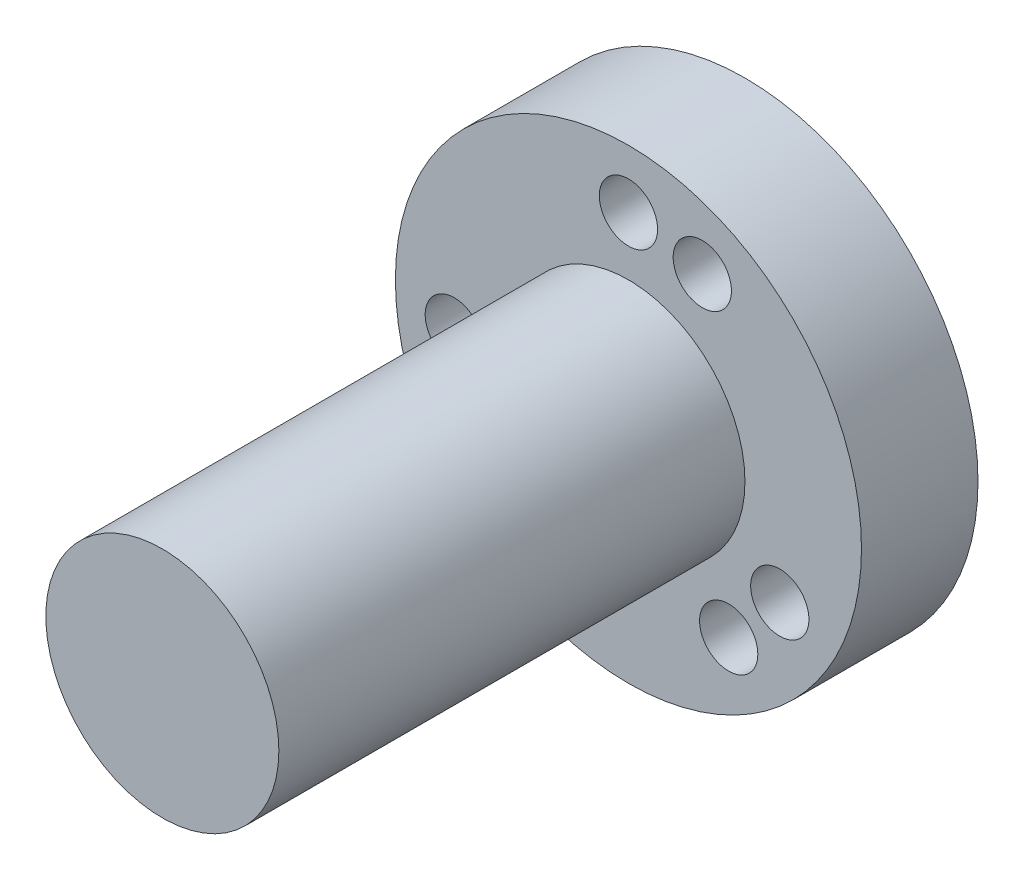
from build123d import *

# Parameters (mm, degrees)
SKETCH_1_R      = 2.5
EXTRUDE_1_DEPTH = 1
SKETCH_2_R      = 6
SKETCH_2_R_2    = 0.75
EXTRUDE_2_DEPTH = 3
SKETCH_3_R      = 3
EXTRUDE_3_DEPTH = 12


with BuildPart() as part:
    # 草图1 → 凸台-拉伸1 (new body)
    with BuildSketch(Plane.XY):
        Circle(SKETCH_1_R)
    extrude(amount=EXTRUDE_1_DEPTH)

    # 草图2 → 凸台-拉伸2 (add)
    with BuildSketch(Plane.XY.offset(1)):
        Circle(SKETCH_2_R)
        with Locations((0, 4.5)):
            Circle(SKETCH_2_R_2, mode=Mode.SUBTRACT)
        with Locations((1.901782178, 4.078385042)):
            Circle(SKETCH_2_R_2, mode=Mode.SUBTRACT)
        with Locations((3.897114317, -2.25)):
            Circle(SKETCH_2_R_2, mode=Mode.SUBTRACT)
        with Locations((2.581093964, -3.686184199)):
            Circle(SKETCH_2_R_2, mode=Mode.SUBTRACT)
        with Locations((-3.897114317, -2.25)):
            Circle(SKETCH_2_R_2, mode=Mode.SUBTRACT)
        with Locations((-4.482876141, -0.392200842)):
            Circle(SKETCH_2_R_2, mode=Mode.SUBTRACT)
    extrude(amount=EXTRUDE_2_DEPTH)

    # 草图3 → 凸台-拉伸3 (add)
    with BuildSketch(Plane.XY.offset(4)):
        Circle(SKETCH_3_R)
    extrude(amount=EXTRUDE_3_DEPTH)


solid = part.part
